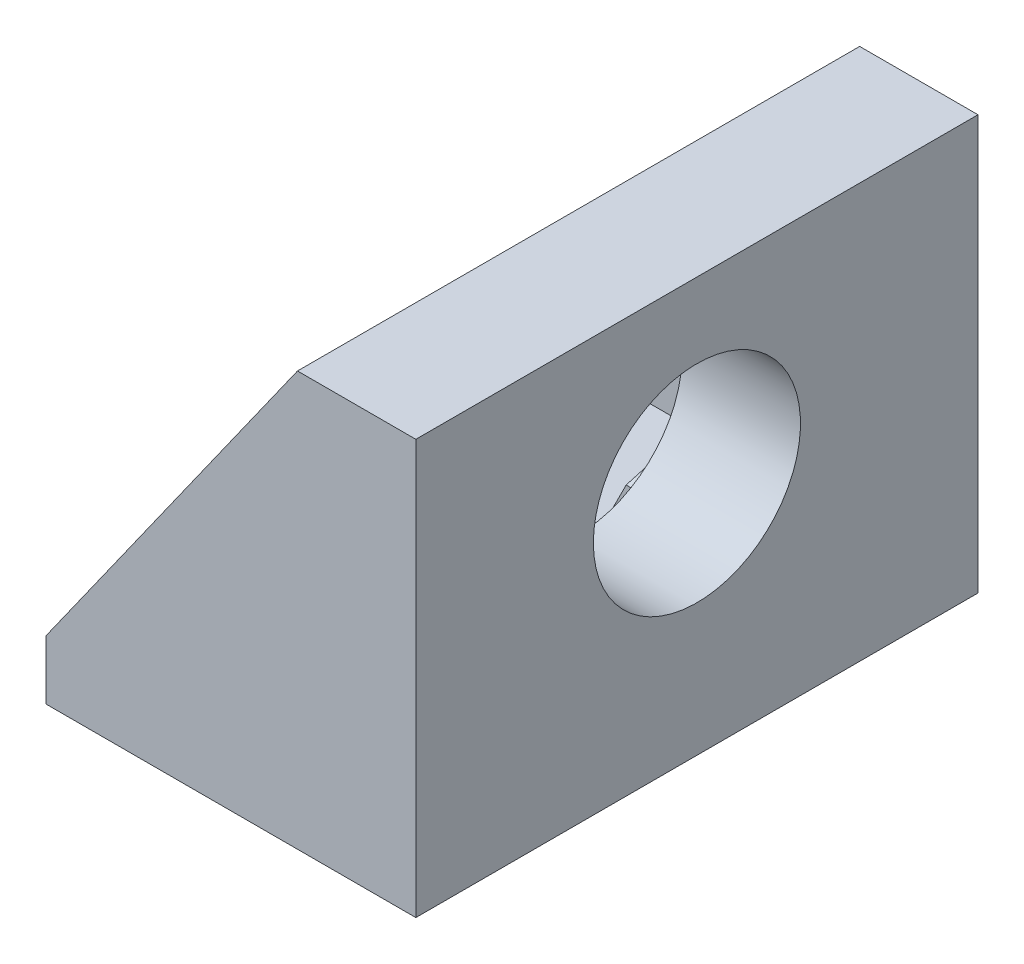
from build123d import *

# Parameters (mm, degrees)
SKETCH1_W           = 12.5
SKETCH1_H           = 15
BOSS_EXTRUDE1_DEPTH = 2
SKETCH4_W           = 4
SKETCH4_H           = 15
BOSS_EXTRUDE2_DEPTH = 12
BOSS_EXTRUDE3_DEPTH = 4
SKETCH5_R           = 3.5
CUT_EXTRUDE2_DEPTH  = 19.013883535
SKETCH9_R           = 5.9
CUT_EXTRUDE4_DEPTH  = 3
BOSS_EXTRUDE4_DEPTH = 2


with BuildPart() as part:
    # Sketch1 → Boss-Extrude1 (new body)
    with BuildSketch(Plane(origin=(0, 0, 0), x_dir=(1, 0, 0), z_dir=(0, 1, 0))):
        Rectangle(SKETCH1_W, SKETCH1_H)
    extrude(amount=BOSS_EXTRUDE1_DEPTH)

    # Sketch4 → Boss-Extrude2 (add)
    with BuildSketch(Plane(origin=(0, 2, 0), x_dir=(1, 0, 0), z_dir=(0, 1, 0))):
        with Locations((4.25, 0)):
            Rectangle(SKETCH4_W, SKETCH4_H)
    extrude(amount=BOSS_EXTRUDE2_DEPTH)

    # Sketch8 → Boss-Extrude3 (add)
    with BuildSketch(Plane.XY.offset(7.5)):
        Polygon((2.25, 2), (2.25, 7), (-0.25, 2), align=None)
    boss_extrude3 = extrude(amount=-BOSS_EXTRUDE3_DEPTH)

    # Sketch5 → Cut-Extrude2 (cut, through all)
    with BuildSketch(Plane.ZY.offset(-2.25)):
        with Locations((0, 7.965)):
            Circle(SKETCH5_R)
    extrude(amount=-CUT_EXTRUDE2_DEPTH, mode=Mode.SUBTRACT)

    # Sketch10 → CSK for #6 Flat Head Machine Screw (100)1 (revolve, cut)
    with BuildSketch(Plane(origin=(-2.25, 2, 0), x_dir=(0, 0, 1), z_dir=(1, 0, 0))):
        Polygon((0, 0), (0, 2), (2.15265, 2), (2.15265, 1.166893902), (3.5433, 0), align=None)
    revolve(axis=Axis((-2.25, 8.35, 0), (0, -1, 0)), mode=Mode.SUBTRACT)

    # Mirror1: Boss-Extrude3 across plane
    add(boss_extrude3.mirror(Plane.XY))

    # Sketch9 → Cut-Extrude4 (cut)
    with BuildSketch(Plane.ZY.offset(-2.25)):
        with Locations((0, 7.965)):
            Circle(SKETCH9_R)
    extrude(amount=CUT_EXTRUDE4_DEPTH, mode=Mode.SUBTRACT)

    # Sketch12 → Boss-Extrude4 (add)
    with BuildSketch(Plane.XY.offset(7.5)):
        Polygon((2.25, 14), (-6.25, 2), (-6.25, 0), (6.25, 0), (6.25, 14), align=None)
    boss_extrude4 = extrude(amount=BOSS_EXTRUDE4_DEPTH)

    # Mirror2: Boss-Extrude4 across plane
    add(boss_extrude4.mirror(Plane.XY))


solid = part.part
